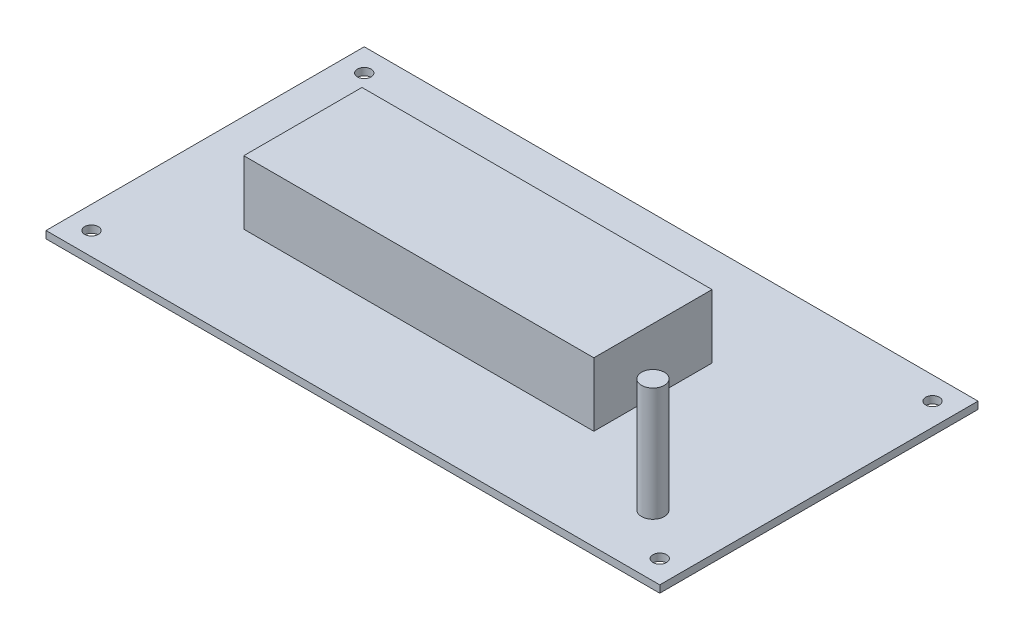
from build123d import *

# Parameters (mm, degrees)
SKETCH1_W           = 135
SKETCH1_H           = 70
BOSS_EXTRUDE1_DEPTH = 1.6
CUT_EXTRUDE1_REACH  = 78.051
SKETCH2_R           = 1.5
SKETCH3_R           = 2.5
BOSS_EXTRUDE2_DEPTH = 25
SKETCH4_W           = 77
SKETCH4_H           = 26
BOSS_EXTRUDE3_DEPTH = 14


with BuildPart() as part:
    # Sketch1 → Boss-Extrude1 (new body)
    with BuildSketch(Plane(origin=(0, 0, 0), x_dir=(1, 0, 0), z_dir=(0, 1, 0))):
        Rectangle(SKETCH1_W, SKETCH1_H)
    extrude(amount=BOSS_EXTRUDE1_DEPTH)

    # Sketch2 → Cut-Extrude1 (cut, up to next)
    with BuildSketch(Plane(origin=(0, 1.6, 0), x_dir=(1, 0, 0), z_dir=(0, 1, 0)), mode=Mode.PRIVATE) as cut_extrude1_sk1:
        with Locations(Location((62.5, 30, 0), (0, 0, 270))):
            Circle(SKETCH2_R)
    cut_extrude1_tool1 = extrude(cut_extrude1_sk1.sketch, amount=-CUT_EXTRUDE1_REACH, mode=Mode.PRIVATE) & part.part
    # Sketch2 → Cut-Extrude1 (cut, up to next)
    with BuildSketch(Plane(origin=(0, 1.6, 0), x_dir=(1, 0, 0), z_dir=(0, 1, 0)), mode=Mode.PRIVATE) as cut_extrude1_sk2:
        with Locations(Location((-62.5, 30, 0), (0, 0, 270))):
            Circle(SKETCH2_R)
    cut_extrude1_tool2 = extrude(cut_extrude1_sk2.sketch, amount=-CUT_EXTRUDE1_REACH, mode=Mode.PRIVATE) & part.part
    # Sketch2 → Cut-Extrude1 (cut, up to next)
    with BuildSketch(Plane(origin=(0, 1.6, 0), x_dir=(1, 0, 0), z_dir=(0, 1, 0)), mode=Mode.PRIVATE) as cut_extrude1_sk3:
        with Locations(Location((-62.5, -30, 0), (0, 0, 270))):
            Circle(SKETCH2_R)
    cut_extrude1_tool3 = extrude(cut_extrude1_sk3.sketch, amount=-CUT_EXTRUDE1_REACH, mode=Mode.PRIVATE) & part.part
    # Sketch2 → Cut-Extrude1 (cut, up to next)
    with BuildSketch(Plane(origin=(0, 1.6, 0), x_dir=(1, 0, 0), z_dir=(0, 1, 0)), mode=Mode.PRIVATE) as cut_extrude1_sk4:
        with Locations(Location((62.5, -30, 0), (0, 0, 270))):
            Circle(SKETCH2_R)
    cut_extrude1_tool4 = extrude(cut_extrude1_sk4.sketch, amount=-CUT_EXTRUDE1_REACH, mode=Mode.PRIVATE) & part.part
    add(cut_extrude1_tool1.solids().sort_by_distance((62.5, 1.6, -30))[0], mode=Mode.SUBTRACT)
    add(cut_extrude1_tool2.solids().sort_by_distance((-62.5, 1.6, -30))[0], mode=Mode.SUBTRACT)
    add(cut_extrude1_tool3.solids().sort_by_distance((-62.5, 1.6, 30))[0], mode=Mode.SUBTRACT)
    add(cut_extrude1_tool4.solids().sort_by_distance((62.5, 1.6, 30))[0], mode=Mode.SUBTRACT)

    # Sketch3 → Boss-Extrude2 (add)
    with BuildSketch(Plane(origin=(0, 1.6, 0), x_dir=(1, 0, 0), z_dir=(0, 1, 0))):
        with Locations(Location((52.5, -21.5, 0), (0, 0, 90))):
            Circle(SKETCH3_R)
    extrude(amount=BOSS_EXTRUDE2_DEPTH)

    # Sketch4 → Boss-Extrude3 (add)
    with BuildSketch(Plane(origin=(0, 1.6, 0), x_dir=(1, 0, 0), z_dir=(0, 1, 0))):
        with Locations((-7.5, 0)):
            Rectangle(SKETCH4_W, SKETCH4_H)
    extrude(amount=BOSS_EXTRUDE3_DEPTH)


solid = part.part
